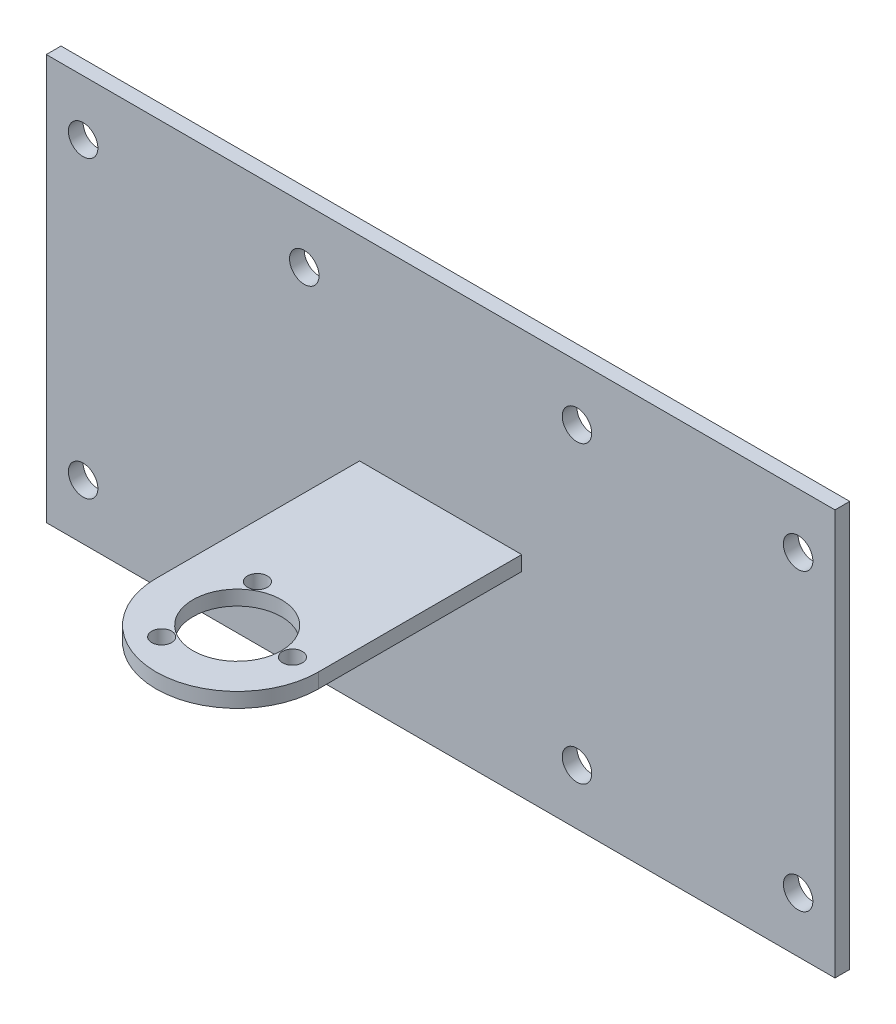
from build123d import *

# Parameters (mm, degrees)
CROQUIS1_W              = 107
CROQUIS1_H              = 55
CROQUIS1_R              = 2
SALIENTE_EXTRUIR1_DEPTH = 2
CROQUIS2_W              = 22
CROQUIS2_H              = 2
SALIENTE_EXTRUIR2_DEPTH = 27.6
CROQUIS3_R              = 11
SALIENTE_EXTRUIR3_DEPTH = 2
CROQUIS4_R              = 6
CORTAR_EXTRUIR1_DEPTH   = 187.15
CROQUIS6_R              = 1.35
CORTAR_EXTRUIR2_DEPTH   = 187.15


with BuildPart() as part:
    # Croquis1 → Saliente-Extruir1 (new body)
    with BuildSketch(Plane.XY):
        Rectangle(CROQUIS1_W, CROQUIS1_H)
        with Locations((-48.5, 20)):
            Circle(CROQUIS1_R, mode=Mode.SUBTRACT)
        with Locations((-48.5, -20)):
            Circle(CROQUIS1_R, mode=Mode.SUBTRACT)
        with Locations((-18.5, 20)):
            Circle(CROQUIS1_R, mode=Mode.SUBTRACT)
        with Locations((-18.5, -20)):
            Circle(CROQUIS1_R, mode=Mode.SUBTRACT)
        with Locations(Location((48.5, -20, 0), (0, 0, 180))):
            Circle(CROQUIS1_R, mode=Mode.SUBTRACT)
        with Locations(Location((18.5, -20, 0), (0, 0, 180))):
            Circle(CROQUIS1_R, mode=Mode.SUBTRACT)
        with Locations(Location((18.5, 20, 0), (0, 0, 180))):
            Circle(CROQUIS1_R, mode=Mode.SUBTRACT)
        with Locations(Location((48.5, 20, 0), (0, 0, 180))):
            Circle(CROQUIS1_R, mode=Mode.SUBTRACT)
    extrude(amount=SALIENTE_EXTRUIR1_DEPTH)

    # Croquis2 → Saliente-Extruir2 (add)
    with BuildSketch(Plane(origin=(0, 0, 2), x_dir=(-1, 0, 0), z_dir=(0, 0, -1))):
        Rectangle(CROQUIS2_W, CROQUIS2_H)
    extrude(amount=-SALIENTE_EXTRUIR2_DEPTH)

    # Croquis3 → Saliente-Extruir3 (add)
    with BuildSketch(Plane(origin=(0, 1, 0), x_dir=(1, 0, 0), z_dir=(0, 1, 0))):
        with Locations((0, -29.6)):
            Circle(CROQUIS3_R)
    extrude(amount=-SALIENTE_EXTRUIR3_DEPTH)

    # Croquis4 → Cortar-Extruir1 (cut)
    with BuildSketch(Plane(origin=(0, 1, 0), x_dir=(1, 0, 0), z_dir=(0, 1, 0))):
        with Locations(Location((0, -29.6, 0), (0, 0, 270))):
            Circle(CROQUIS4_R)
    extrude(amount=-CORTAR_EXTRUIR1_DEPTH, mode=Mode.SUBTRACT)

    # Croquis6 → Cortar-Extruir2 (cut)
    with BuildSketch(Plane(origin=(0, 1, 0), x_dir=(1, 0, 0), z_dir=(0, 1, 0))):
        with Locations(Location((7.5, -29.6, 0), (0, 0, 270))):
            Circle(CROQUIS6_R)
        with Locations(Location((-3.75, -36.095190528, 0), (0, 0, 270))):
            Circle(CROQUIS6_R)
        with Locations(Location((-3.75, -23.104809472, 0), (0, 0, 270))):
            Circle(CROQUIS6_R)
    extrude(amount=-CORTAR_EXTRUIR2_DEPTH, mode=Mode.SUBTRACT)


solid = part.part
